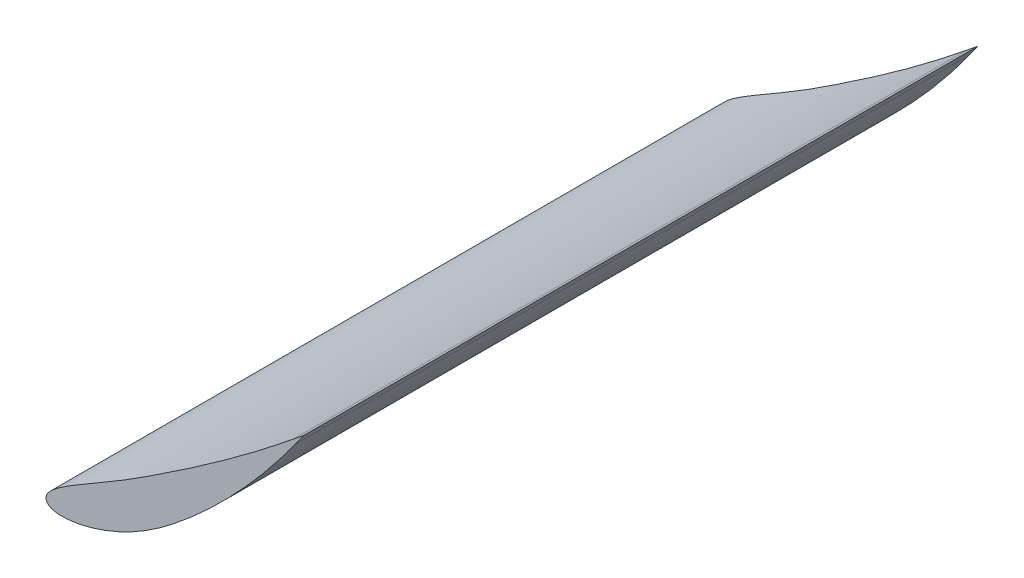
from build123d import *

# Parameters (mm, degrees)
BOSS_EXTRUDE3_DEPTH = 431.8


with BuildPart() as part:
    # Sketch3 → Boss-Extrude3 (new body)
    with BuildSketch(Plane.XY):
        with BuildLine():
            Line((157.468061095, 113.860792096), (164.392253257, 119.437963266))
            Line((164.392253257, 119.437963266), (158.910857998, 111.832738784))
            add(Edge.make_bspline(
                [(158.910857998, 111.832738784), (157.690394331, 110.139392524), (156.46432559, 108.45117595), (153.986024633, 105.098687239), (152.736168633, 103.432240424), (148.954675272, 98.462117614), (146.391356472, 95.187436021), (138.574880374, 85.479180263), (133.196506362, 79.16020265), (122.098231747, 66.834807687), (116.378873199, 60.827894257), (104.56811537, 49.154553769), (98.477321747, 43.487572422), (90.592124068, 36.652506873), (89.000333181, 35.297044552), (85.792807171, 32.617725507), (84.177985369, 31.294953309), (79.301584899, 27.37540312), (76.014809232, 24.817102178), (69.26716849, 19.966343336), (65.813096332, 17.66351232), (58.732435338, 13.321291692), (55.105690154, 11.282140832), (49.521062366, 8.444088398), (47.635387467, 7.534922128), (43.811942994, 5.796140704), (41.878892591, 4.968824577), (36.042052231, 2.634042243), (32.089951938, 1.265672228), (26.049281198, -0.439097517), (24.016834276, -0.948967596), (20.93347727, -1.606560975), (19.898177632, -1.807922502), (17.824515165, -2.167404046), (16.786008283, -2.325412919), (14.705068865, -2.590517861), (13.662665519, -2.697992513), (11.572841246, -2.847867543), (10.525508867, -2.891416318), (8.949260919, -2.888658968), (8.422970931, -2.876404658), (7.368233979, -2.823921668), (6.838289509, -2.783112535), (5.786032612, -2.663997961), (5.263085583, -2.586564434), (4.226184964, -2.38116368), (3.710434421, -2.251850205), (2.700836018, -1.922405309), (2.211058649, -1.723773034), (1.513112853, -1.342933429), (1.2851974, -1.201286909), (0.854486149, -0.890971488), (0.651108002, -0.721974329), (0.273873379, -0.349869021), (0.098662577, -0.144379322), (-0.203287061, 0.291888774), (-0.331757291, 0.523081744), (-0.541704332, 1.012736941), (-0.621623484, 1.269520723), (-0.722191582, 1.787622828), (-0.743022093, 2.053373313), (-0.729122568, 2.588223726), (-0.695316096, 2.850722788), (-0.58518028, 3.367921229), (-0.508234487, 3.624159831), (-0.2260837, 4.371569525), (0.02714828, 4.834037594), (0.605717377, 5.71933499), (0.930757304, 6.142291765), (1.614143374, 6.941720733), (1.973964696, 7.32234596), (3.088003675, 8.427813821), (3.878253218, 9.114714538), (5.505522981, 10.439266006), (6.34539142, 11.075175805), (8.893188923, 12.92496809), (10.636457211, 14.085679495), (14.160758214, 16.345915384), (15.942968547, 17.44353186), (19.526130398, 19.608399849), (21.327508547, 20.674960123), (26.743911572, 23.854763074), (30.370408814, 25.949417918), (37.607212424, 30.164960489), (41.217644504, 32.284445831), (48.395532041, 36.586373796), (51.963149083, 38.768595976), (57.270195543, 42.106974893), (59.031767507, 43.230677703), (62.537782426, 45.503189), (64.28277114, 46.651197578), (69.515570758, 50.098398748), (73.003639754, 52.39721306), (83.438667358, 59.336423687), (90.36271993, 64.010392966), (104.10289574, 73.516521597), (110.91919608, 78.348421372), (124.42704321, 88.195069942), (131.119225282, 93.208887616), (141.066534859, 100.862937729), (144.367966202, 103.436280005), (149.296894117, 107.324827896), (150.935955142, 108.625940925), (154.207109492, 111.236941952), (155.83824425, 112.548037148), (157.468061095, 113.860792096)],
                knots=[0, 0, 0, 0, 0.015625, 0.015625, 0.03125, 0.03125, 0.0625, 0.0625, 0.125, 0.125, 0.1875, 0.1875, 0.25, 0.25, 0.265625, 0.265625, 0.28125, 0.28125, 0.3125, 0.3125, 0.34375, 0.34375, 0.375, 0.375, 0.390625, 0.390625, 0.40625, 0.40625, 0.4375, 0.4375, 0.453125, 0.453125, 0.4609375, 0.4609375, 0.46875, 0.46875, 0.4765625, 0.4765625, 0.484375, 0.484375, 0.48828125, 0.48828125, 0.4921875, 0.4921875, 0.49609375, 0.49609375, 0.5, 0.5, 0.50390625, 0.50390625, 0.505859375, 0.505859375, 0.5078125, 0.5078125, 0.509765625, 0.509765625, 0.51171875, 0.51171875, 0.513671875, 0.513671875, 0.515625, 0.515625, 0.517578125, 0.517578125, 0.51953125, 0.51953125, 0.5234375, 0.5234375, 0.52734375, 0.52734375, 0.53125, 0.53125, 0.5390625, 0.5390625, 0.546875, 0.546875, 0.5625, 0.5625, 0.578125, 0.578125, 0.59375, 0.59375, 0.625, 0.625, 0.65625, 0.65625, 0.6875, 0.6875, 0.703125, 0.703125, 0.71875, 0.71875, 0.75, 0.75, 0.8125, 0.8125, 0.875, 0.875, 0.9375, 0.9375, 0.96875, 0.96875, 0.984375, 0.984375, 1, 1, 1, 1], degree=3))
        make_face()
    extrude(amount=BOSS_EXTRUDE3_DEPTH)


solid = part.part
